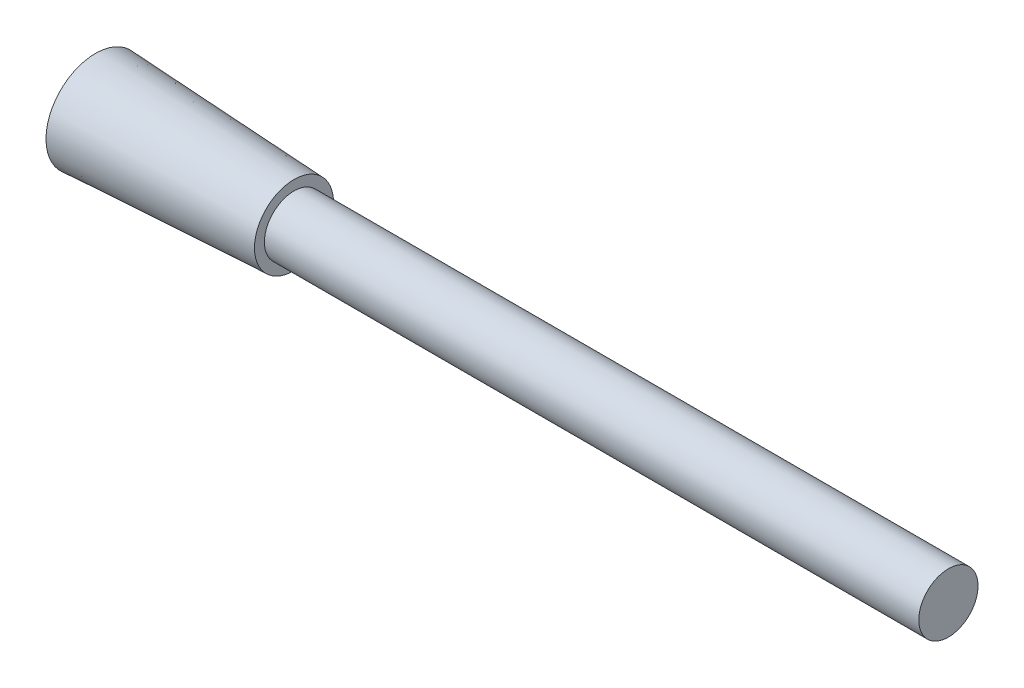
from build123d import *


with BuildPart() as part:
    # 草图1 → 旋转1 (revolve)
    with BuildSketch(Plane(origin=(0, 0, 0), x_dir=(1, 0, 0), z_dir=(0, 1, 0))):
        Polygon((525, -890), (525, -897.5), (555.144519195, -896), (555.144519195, -894.5), (654.474617049, -894.5), (654.474617049, -890), align=None)
    revolve(axis=Axis((525, 0, 890), (1, 0, 0)))


solid = part.part
